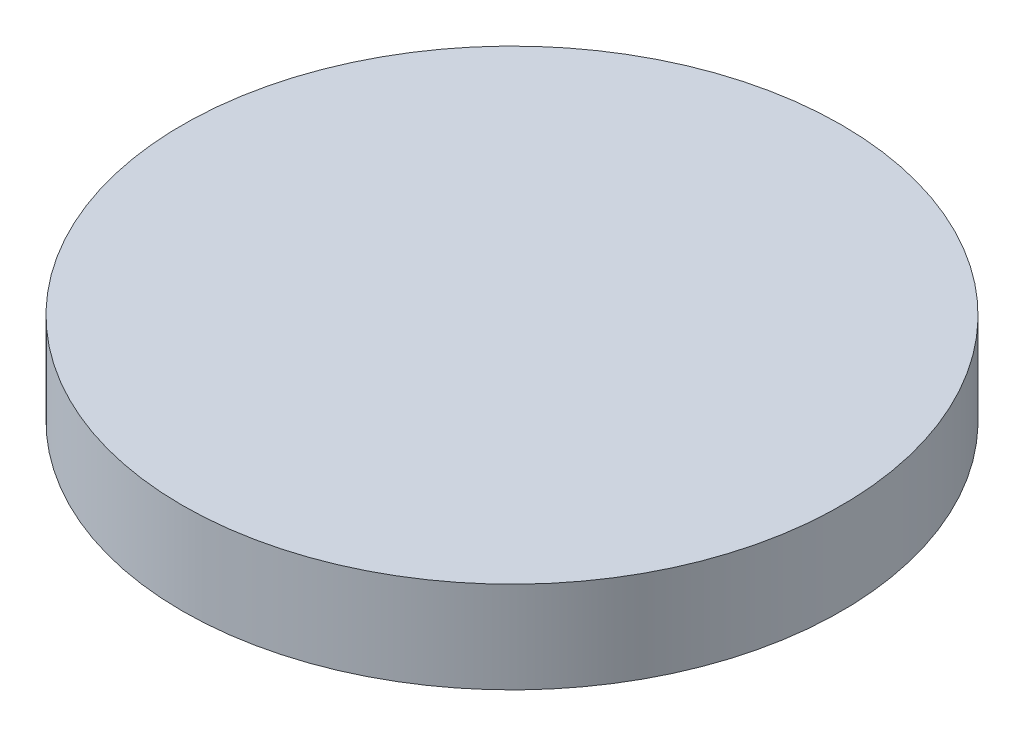
from build123d import *

# Parameters (mm, degrees)
SKETCH_1_R      = 18
EXTRUDE_1_DEPTH = 5


with BuildPart() as part:
    # 草图1 → 凸台-拉伸1 (new body)
    with BuildSketch(Plane(origin=(0, 0, 0), x_dir=(1, 0, 0), z_dir=(0, 1, 0))):
        with Locations(Location((0, 0, 0), (0, 0, 270))):
            Circle(SKETCH_1_R)
    extrude(amount=EXTRUDE_1_DEPTH)


solid = part.part
